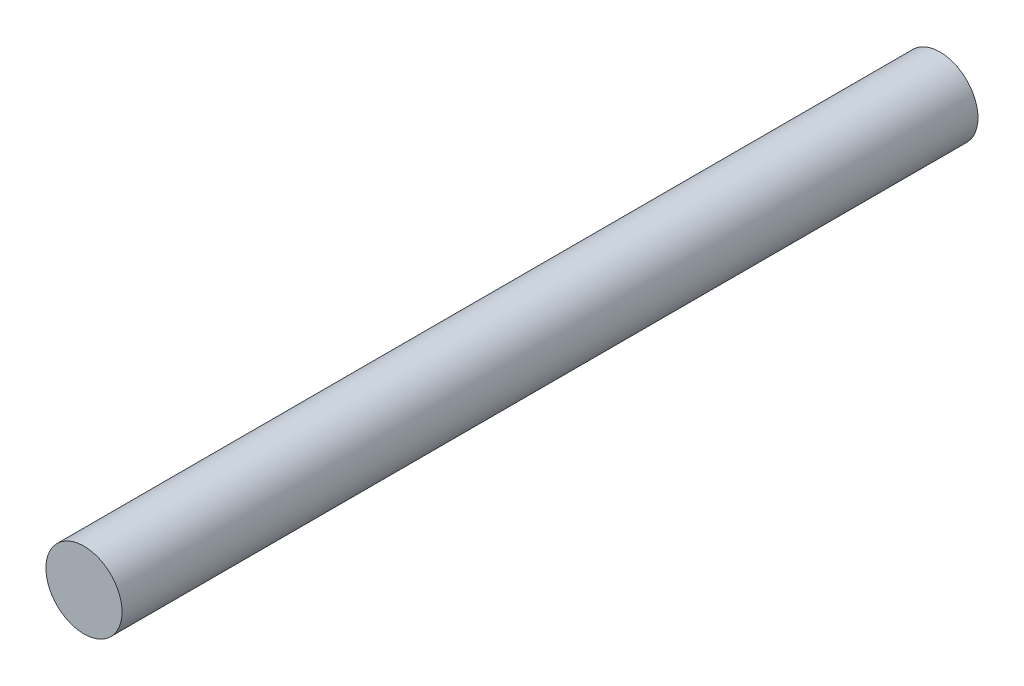
from build123d import *

# Parameters (mm, degrees)
ESQUISSE1_R        = 10
BOSS_EXTRU_1_DEPTH = 112.5


with BuildPart() as part:
    # Esquisse1 → Boss.-Extru.1 (new, symmetric)
    with BuildSketch(Plane.XY):
        Circle(ESQUISSE1_R)
    extrude(amount=BOSS_EXTRU_1_DEPTH, both=True)


solid = part.part
